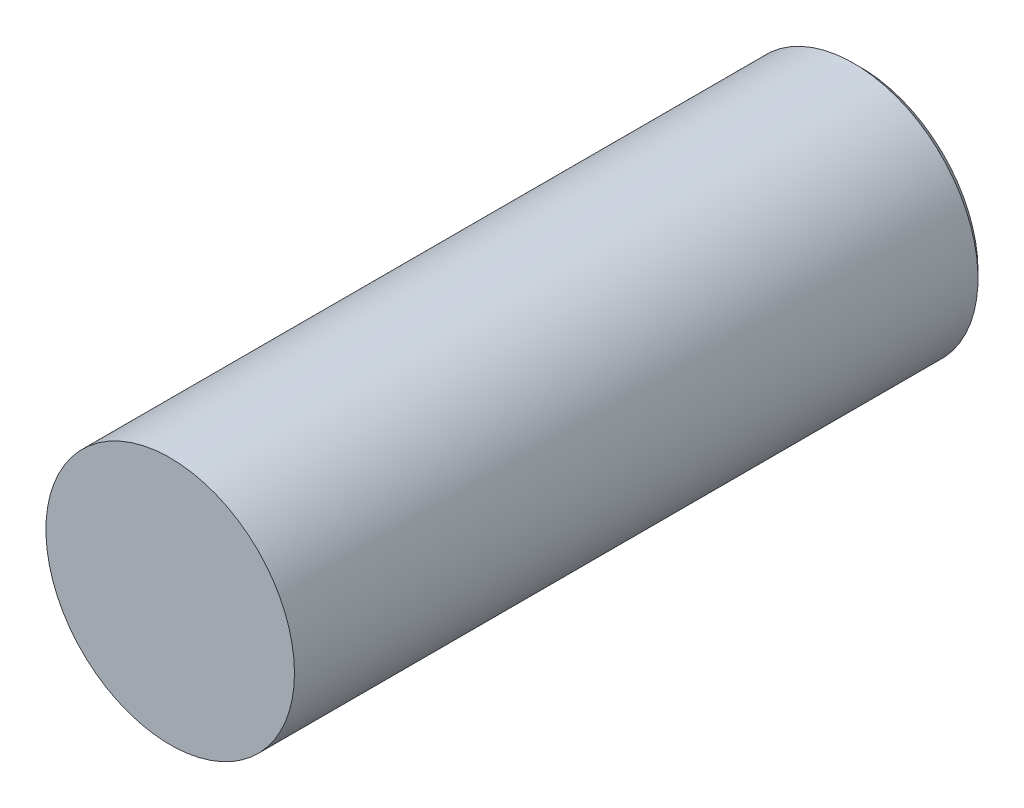
from build123d import *

# Parameters (mm, degrees)
RESSALTO_EXTRUS_O1_DEPTH = 28
ESBO_O3_R                = 9
RESSALTO_EXTRUS_O2_DEPTH = 22
CHANFRO2_SIZE            = 0.5


with BuildPart() as part:
    # Esboço2 → Ressalto-extrusão1 (new body)
    with BuildSketch(Plane.XY):
        with BuildLine():
            Line((-3.024645143, -8.476527695), (-3.024645143, -4.976527695))
            Line((-3.024645143, -4.976527695), (2.975354857, -4.976527695))
            Line((2.975354857, -4.976527695), (2.975354857, -8.493954525))
            ThreePointArc((2.975354857, -8.493954525), (0.026140135, 8.999962038), (-3.024645143, -8.476527695))
        make_face()
    extrude(amount=RESSALTO_EXTRUS_O1_DEPTH)

    # Esboço3 → Ressalto-extrusão2 (add)
    with BuildSketch(Plane.XY.offset(28)):
        with Locations(Location((0, 0, 0), (0, 0, 250.362280418))):
            Circle(ESBO_O3_R)
    extrude(amount=RESSALTO_EXTRUS_O2_DEPTH)

    # Chanfro2
    chanfro2_edges = [part.edges().sort_by_distance(p)[0] for p in [
        (0.026140135, 8.999962038, 0),
    ]]
    chamfer(chanfro2_edges, length=CHANFRO2_SIZE)


solid = part.part
